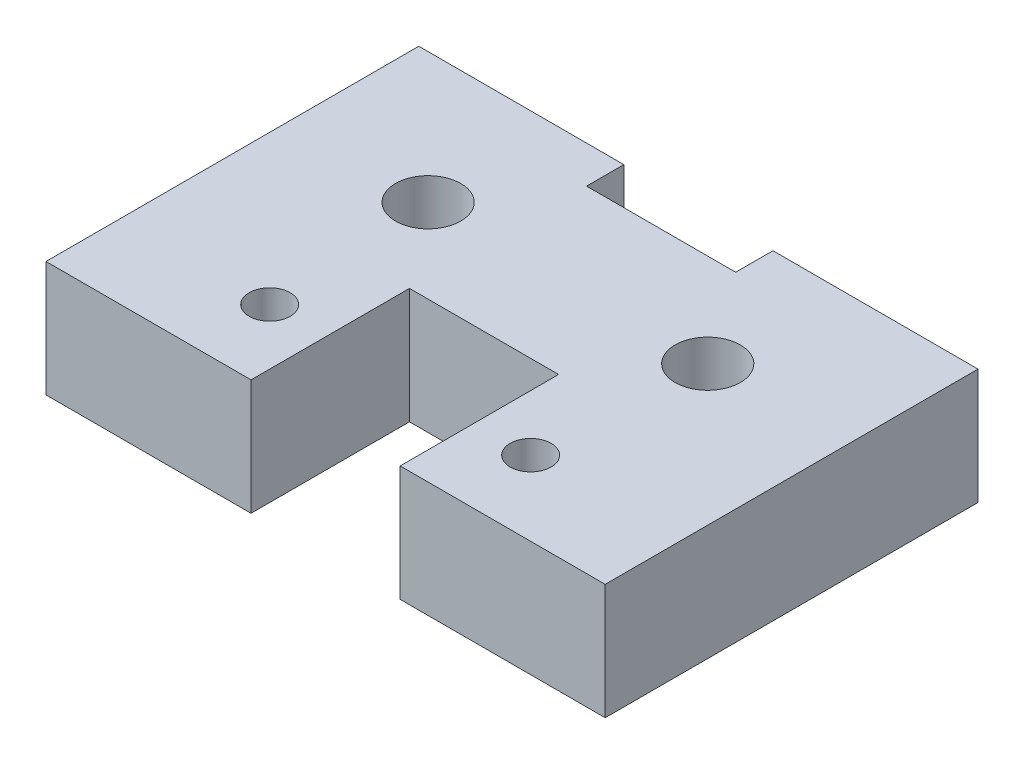
from build123d import *

# Parameters (mm, degrees)
SKETCH_1_W          = 30
SKETCH_1_H          = 20
EXTRUDE_1_DEPTH     = 4.2
SKETCH_2_R          = 3.05
CUT_EXTRUDE_1_DEPTH = 19.510537539
SKETCH_3_W          = 8
SKETCH_3_H          = 8.5
CUT_EXTRUDE_2_DEPTH = 19.510537539
EXTRUDE_2_DEPTH     = 2
SKETCH_5_R          = 1.75
CUT_EXTRUDE_3_DEPTH = 19.510537539
SKETCH_6_W          = 8
SKETCH_6_H          = 2
CUT_EXTRUDE_4_DEPTH = 20.064102392
SKETCH_7_R          = 1.1
CUT_EXTRUDE_5_DEPTH = 20.064102392
SKETCH_8_W          = 2.8
SKETCH_8_H          = 2.8
EXTRUDE_3_DEPTH     = 3
SKETCH_9_R          = 3.05
SKETCH_9_R_2        = 1.75
EXTRUDE_4_DEPTH     = 3.8


with BuildPart() as part:
    # 草图1 → 凸台-拉伸1 (new body)
    with BuildSketch(Plane(origin=(0, 0, 0), x_dir=(1, 0, 0), z_dir=(0, 1, 0))):
        Rectangle(SKETCH_1_W, SKETCH_1_H)
    extrude(amount=EXTRUDE_1_DEPTH)

    # 草图2 → 切除-拉伸1 (cut, through all)
    with BuildSketch(Plane(origin=(0, 4.2, 0), x_dir=(1, 0, 0), z_dir=(0, 1, 0))):
        with Locations(Location((-7.5, 3, 0), (0, 0, 270))):
            Circle(SKETCH_2_R)
        with Locations(Location((7.5, 3, 0), (0, 0, 270))):
            Circle(SKETCH_2_R)
    extrude(amount=-CUT_EXTRUDE_1_DEPTH, mode=Mode.SUBTRACT)

    # 草图3 → 切除-拉伸2 (cut, through all)
    with BuildSketch(Plane(origin=(0, 4.2, 0), x_dir=(1, 0, 0), z_dir=(0, 1, 0))):
        with Locations((0, -5.75)):
            Rectangle(SKETCH_3_W, SKETCH_3_H)
    extrude(amount=-CUT_EXTRUDE_2_DEPTH, mode=Mode.SUBTRACT)

    # 草图4 → 凸台-拉伸2 (add)
    with BuildSketch(Plane(origin=(0, 4.2, 0), x_dir=(1, 0, 0), z_dir=(0, 1, 0))):
        Polygon((-4, -1.5), (4, -1.5), (4, -10), (15, -10), (15, 10), (-15, 10), (-15, -10), (-4, -10), align=None)
    extrude(amount=EXTRUDE_2_DEPTH)

    # 草图5 → 切除-拉伸3 (cut, through all)
    with BuildSketch(Plane.XZ.offset(-4.2)):
        with Locations(Location((-7.5, -3, 0), (0, 0, 270))):
            Circle(SKETCH_5_R)
        with Locations(Location((7.5, -3, 0), (0, 0, 270))):
            Circle(SKETCH_5_R)
    extrude(amount=-CUT_EXTRUDE_3_DEPTH, mode=Mode.SUBTRACT)

    # 草图6 → 切除-拉伸4 (cut, through all)
    with BuildSketch(Plane(origin=(0, 6.2, 0), x_dir=(1, 0, 0), z_dir=(0, 1, 0))):
        with Locations((0, 9)):
            Rectangle(SKETCH_6_W, SKETCH_6_H)
    extrude(amount=-CUT_EXTRUDE_4_DEPTH, mode=Mode.SUBTRACT)

    # 草图7 → 切除-拉伸5 (cut, through all)
    with BuildSketch(Plane(origin=(0, 6.2, 0), x_dir=(1, 0, 0), z_dir=(0, 1, 0))):
        with Locations(Location((-7, -6, 0), (0, 0, 270))):
            Circle(SKETCH_7_R)
        with Locations(Location((7, -6, 0), (0, 0, 90))):
            Circle(SKETCH_7_R)
    extrude(amount=-CUT_EXTRUDE_5_DEPTH, mode=Mode.SUBTRACT)

    # 草图8 → 凸台-拉伸3 (add)
    with BuildSketch(Plane.XZ):
        with Locations((0, -5)):
            Rectangle(SKETCH_8_W, SKETCH_8_H)
    extrude(amount=EXTRUDE_3_DEPTH)

    # 草图9 → 凸台-拉伸4 (add)
    # profile 1 of 2: a face of its own
    with BuildSketch(Plane.XZ.offset(-4.2)):
        with Locations(Location((7.5, -3, 0), (0, 0, 90))):
            Circle(SKETCH_9_R)
        with Locations(Location((7.5, -3, 0), (0, 0, 270))):
            Circle(SKETCH_9_R_2, mode=Mode.SUBTRACT)
    # profile 2 of 2: a face of its own
    with BuildSketch(Plane.XZ.offset(-4.2)):
        with Locations(Location((-7.5, -3, 0), (0, 0, 90))):
            Circle(SKETCH_9_R)
        with Locations(Location((-7.5, -3, 0), (0, 0, 270))):
            Circle(SKETCH_9_R_2, mode=Mode.SUBTRACT)
    extrude(amount=EXTRUDE_4_DEPTH)


solid = part.part
